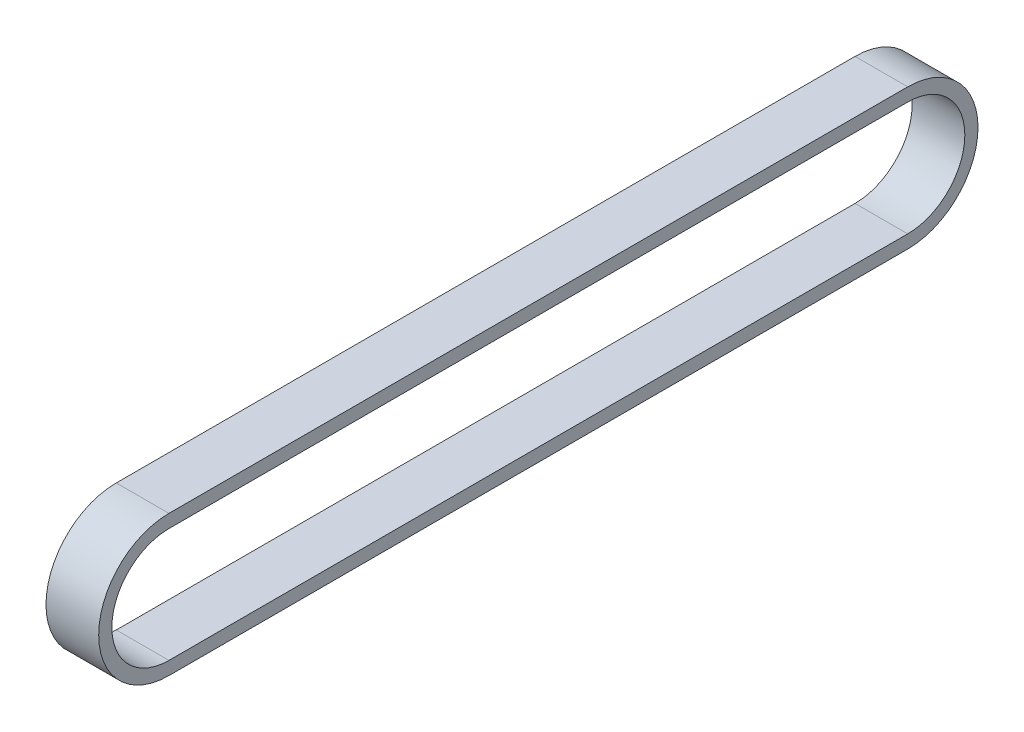
from build123d import *

# Parameters (mm, degrees)
SKETCH_1_R               = 18.541316536
EXTRUDE_1_DEPTH          = 10
SKETCH_2_R               = 65
EXTRUDE_2_DEPTH          = 60
CUT_EXTRUDE_1_DEPTH      = 554.983106248
CUT_EXTRUDE_1_DEPTH_BACK = 554.983106248
CUT_EXTRUDE_2_DEPTH      = 554.983106248
CUT_EXTRUDE_2_DEPTH_BACK = 554.983106248
SKETCH_4_W               = 491.25
SKETCH_4_H               = 130
EXTRUDE_START            = -60
EXTRUDE_3_DEPTH          = 60
CUT_EXTRUDE_3_DEPTH      = 229


with BuildPart() as part:
    # 草图1 → 凸台-拉伸1 (new body)
    with BuildSketch(Plane(origin=(0, 0, 0), x_dir=(0, 0, -1), z_dir=(1, 0, 0))):
        Circle(SKETCH_1_R)
    extrude(amount=EXTRUDE_1_DEPTH)

    # 草图2 → 凸台-拉伸2 (add)
    with BuildSketch(Plane.ZY):
        with BuildLine():
            Line((-46.012206562, -5.59753124), (445.237793438, -5.59753124))
            ThreePointArc((445.237793438, -5.59753124), (525.237793438, -85.59753124), (445.237793438, -165.59753124))
            Line((445.237793438, -165.59753124), (-46.012206562, -165.59753124))
            ThreePointArc((-46.012206562, -165.59753124), (-126.012206562, -85.59753124), (-46.012206562, -5.59753124))
        make_face()
        with Locations((-46.012206562, -85.59753124)):
            Circle(SKETCH_2_R, mode=Mode.SUBTRACT)
        with Locations((445.237793438, -85.59753124)):
            Circle(SKETCH_2_R, mode=Mode.SUBTRACT)
    extrude(amount=-EXTRUDE_2_DEPTH)

    # 草图3 → 切除-拉伸1 (cut, two sides: drawn at the far end of the back side and taken through both)
    with BuildSketch(Plane.ZY.offset(-CUT_EXTRUDE_1_DEPTH_BACK)):
        Polygon((-32.271946136, -5.59753124), (45.25223132, -5.59753124), (36.799677621, 39.571185564), (-16.420104924, 39.571185564), align=None)
    extrude(amount=CUT_EXTRUDE_1_DEPTH + CUT_EXTRUDE_1_DEPTH_BACK, mode=Mode.SUBTRACT)

    # 草图4 → 切除-拉伸2 (cut, two sides: drawn at the far end of the back side and taken through both)
    with BuildSketch(Plane.ZY.offset(-CUT_EXTRUDE_2_DEPTH_BACK)):
        with Locations((199.612793438, -85.59753124)):
            Rectangle(SKETCH_4_W, SKETCH_4_H)
    extrude(amount=CUT_EXTRUDE_2_DEPTH + CUT_EXTRUDE_2_DEPTH_BACK, mode=Mode.SUBTRACT)

    # 草图6 → 凸台-拉伸3 (add)
    with BuildSketch(Plane(origin=(60, 0, 0), x_dir=(0, 0, -1), z_dir=(1, 0, 0)).offset(EXTRUDE_START)):
        with BuildLine():
            Line((-795.237793438, -5.59753124), (46.012206562, -5.59753124))
            ThreePointArc((46.012206562, -5.59753124), (126.012206562, -85.59753124), (46.012206562, -165.59753124))
            Line((46.012206562, -165.59753124), (-795.237793438, -165.59753124))
            ThreePointArc((-795.237793438, -165.59753124), (-875.237793438, -85.59753124), (-795.237793438, -5.59753124))
        make_face()
        with BuildLine():
            Line((-795.237793438, -20.59753124), (46.012206562, -20.59753124))
            ThreePointArc((46.012206562, -20.59753124), (111.012206562, -85.59753124), (46.012206562, -150.59753124))
            Line((46.012206562, -150.59753124), (-795.237793438, -150.59753124))
            ThreePointArc((-795.237793438, -150.59753124), (-860.237793438, -85.59753124), (-795.237793438, -20.59753124))
        make_face(mode=Mode.SUBTRACT)
    extrude(amount=EXTRUDE_3_DEPTH)

    # 草图7 → 切除-拉伸3 (cut)
    with BuildSketch(Plane(origin=(60, 0, 0), x_dir=(0, 0, -1), z_dir=(1, 0, 0))):
        Polygon((-547.566166751, -20.59753124), (-408.942471001, -20.59753124), (-408.942471001, -150.59753124), (-543.921935574, -150.59753124), align=None)
    extrude(amount=-CUT_EXTRUDE_3_DEPTH, mode=Mode.SUBTRACT)


solid = part.part
